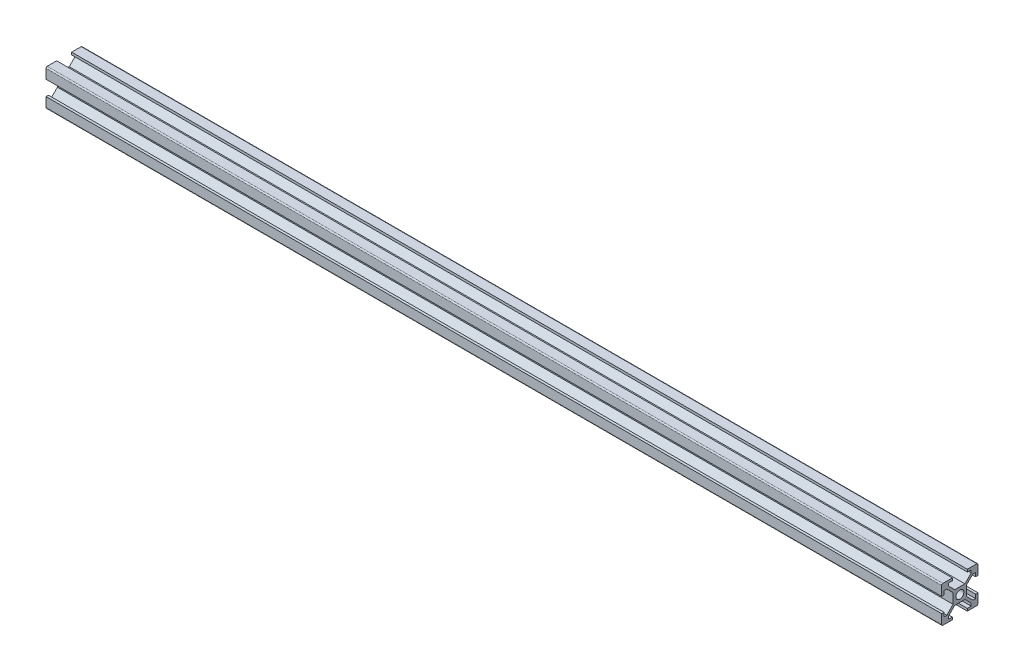
from build123d import *

# Parameters (mm, degrees)
EXTRUDE_1_DEPTH          = 370
CUT_EXTRUDE_2_DEPTH      = 371.151995807
CUT_EXTRUDE_2_DEPTH_BACK = 371.151995807
SKETCH_2_4_R             = 1.65


with BuildPart() as part:
    # 草图2 → 凸台-拉伸1 (new body)
    with BuildSketch(Plane(origin=(0, 0, 0), x_dir=(0, 0, -1), z_dir=(1, 0, 0))):
        with BuildLine():
            Line((-7, 7.5), (7, 7.5))
            ThreePointArc((7, 7.5), (7.353553391, 7.353553391), (7.5, 7))
            Line((7.5, 7), (7.5, -7))
            ThreePointArc((7.5, -7), (7.353553391, -7.353553391), (7, -7.5))
            Line((7, -7.5), (-7, -7.5))
            ThreePointArc((-7, -7.5), (-7.353553391, -7.353553391), (-7.5, -7))
            Line((-7.5, -7), (-7.5, 7))
            ThreePointArc((-7.5, 7), (-7.353553391, 7.353553391), (-7, 7.5))
        make_face()
    extrude(amount=EXTRUDE_1_DEPTH)

    # 草图2<4> → 切除-拉伸2 (cut, two sides: drawn at the far end of the back side and taken through both)
    with BuildSketch(Plane(origin=(0, 0, 0), x_dir=(0, 0, -1), z_dir=(1, 0, 0)).offset(-CUT_EXTRUDE_2_DEPTH_BACK)):
        Polygon((3.1, 7.5), (-3.1, 7.5), (-3.1, 6.5), (-4.7, 6.5), (-4.7, 5.407106781), (-2.092893219, 2.8), (2.092893219, 2.8), (4.7, 5.407106781), (4.7, 6.5), (3.1, 6.5), align=None)
        Polygon((-6.5, 3.1), (-7.5, 3.1), (-7.5, -3.1), (-6.5, -3.1), (-6.5, -4.7), (-5.407106781, -4.7), (-2.8, -2.092893219), (-2.8, 2.092893219), (-5.407106781, 4.7), (-6.5, 4.7), align=None)
        Polygon((7.5, -3.1), (7.5, 3.1), (6.5, 3.1), (6.5, 4.7), (5.407106781, 4.7), (2.8, 2.092893219), (2.8, -2.092893219), (5.407106781, -4.7), (6.5, -4.7), (6.5, -3.1), align=None)
        Polygon((-3.1, -6.5), (-3.1, -7.5), (3.1, -7.5), (3.1, -6.5), (4.7, -6.5), (4.7, -5.407106781), (2.092893219, -2.8), (-2.092893219, -2.8), (-4.7, -5.407106781), (-4.7, -6.5), align=None)
        Circle(SKETCH_2_4_R)
    extrude(amount=CUT_EXTRUDE_2_DEPTH + CUT_EXTRUDE_2_DEPTH_BACK, mode=Mode.SUBTRACT)


solid = part.part
